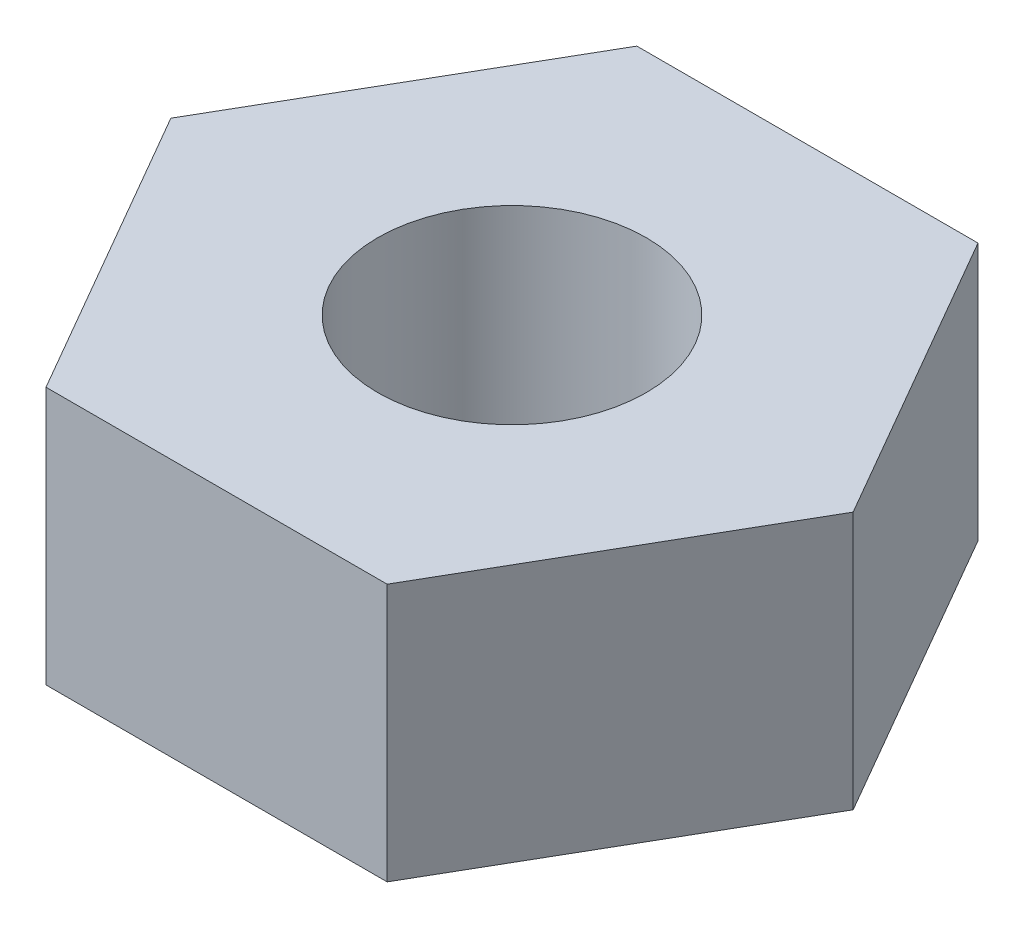
from build123d import *

# Parameters (mm, degrees)
EXTRUDE_1_DEPTH     = 2.4
SKETCH_2_R          = 1.25
CUT_EXTRUDE_1_DEPTH = 2.4


with BuildPart() as part:
    # Эскиз1 → Бобышка-Вытянуть1 (new body)
    with BuildSketch(Plane(origin=(0, 0, 0), x_dir=(1, 0, 0), z_dir=(0, 1, 0))):
        Polygon((-3.175426481, 0), (-1.58771324, -2.75), (1.58771324, -2.75), (3.175426481, 0), (1.58771324, 2.75), (-1.58771324, 2.75), align=None)
    extrude(amount=EXTRUDE_1_DEPTH)

    # Эскиз2 → Вырез-Вытянуть1 (cut)
    with BuildSketch(Plane(origin=(0, 2.4, 0), x_dir=(1, 0, 0), z_dir=(0, 1, 0))):
        with Locations(Location((0, 0, 0), (0, 0, 270))):
            Circle(SKETCH_2_R)
    extrude(amount=-CUT_EXTRUDE_1_DEPTH, mode=Mode.SUBTRACT)


solid = part.part
